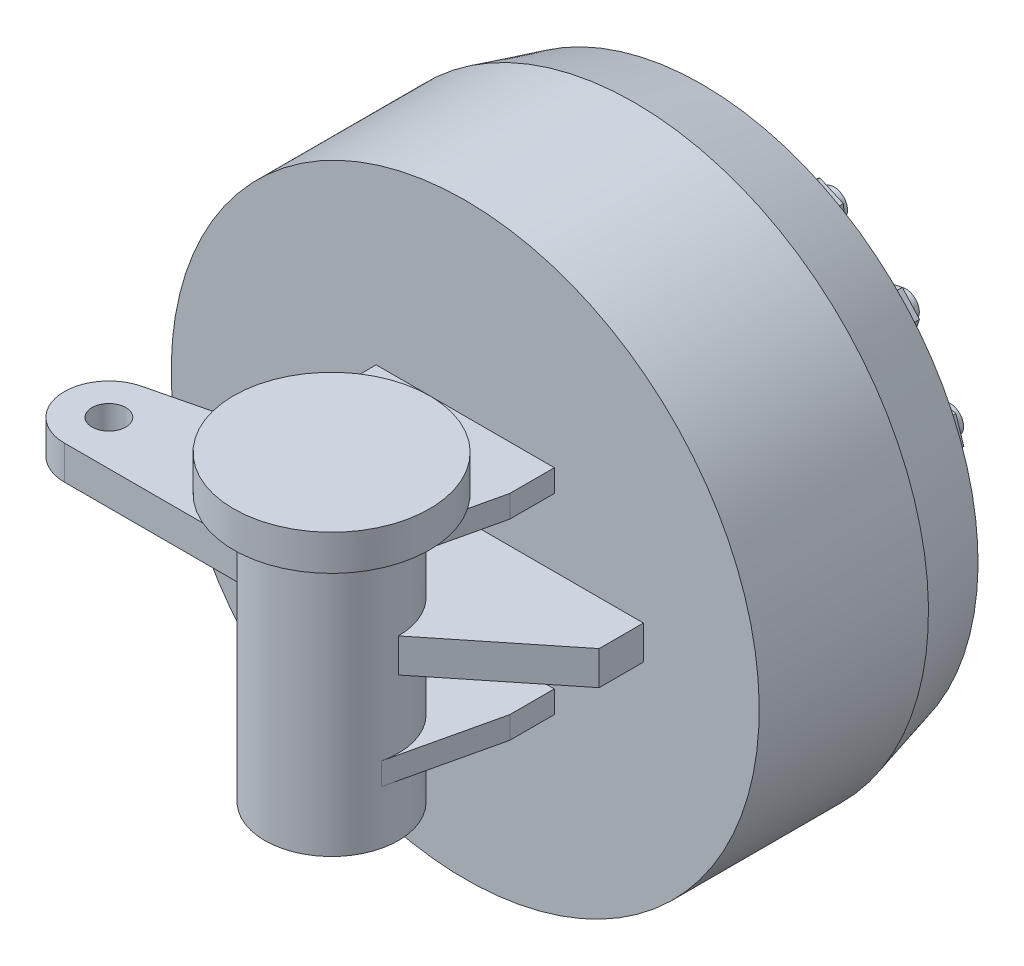
from build123d import *

# Parameters (mm, degrees)
CHAMFER1_SIZE            = 4
FILLET1_R                = 3.5
BOSS_EXTRUDE1_DEPTH      = 80
BOSS_EXTRUDE1_DEPTH_BACK = 90
SKETCH2_R                = 37.5
BOSS_EXTRUDE2_START      = 60
BOSS_EXTRUDE2_DEPTH      = 12.5
SKETCH4_R                = 9.5
BOSS_EXTRUDE3_DEPTH      = 9.5
SKETCH5_R                = 55
BOSS_EXTRUDE4_DEPTH      = 20
SKETCH6_R                = 7.5
BOSS_EXTRUDE5_DEPTH      = 25
BOSS_EXTRUDE6_START      = 6
SKETCH6_3_R              = 7.5
BOSS_EXTRUDE6_DEPTH      = 12.5
CIRPATTERN1_COUNT        = 15


with BuildPart() as part:
    # Sketch1 → Revolve1 (revolve)
    with BuildSketch(Plane(origin=(0, 0, 0), x_dir=(0, 0, -1), z_dir=(1, 0, 0))):
        Polygon((0, 0), (0, 165), (95, 165), (133, 154.817930688), (133, 75), (158, 75), (158, 50), (183, 50), (183, 0), align=None)
    revolve(axis=Axis((0, 0, -183), (0, 0, 1)))

    # Chamfer1
    chamfer1_edges = [part.edges().sort_by_distance(p)[0] for p in [
        (0, -50, -183),
    ]]
    chamfer(chamfer1_edges, length=CHAMFER1_SIZE)

    # Fillet1
    fillet1_edges = [part.edges().sort_by_distance(p)[0] for p in [
        (0, -50, -158),
        (0, -75, -158),
    ]]
    fillet(fillet1_edges, radius=FILLET1_R)



with BuildPart() as body_2:
    # Sketch2 → Boss-Extrude1 (new, two sides: drawn at the far end of the back side and taken through both)
    with BuildSketch(Plane(origin=(0, 0, 0), x_dir=(1, 0, 0), z_dir=(0, 1, 0)).offset(-BOSS_EXTRUDE1_DEPTH_BACK)):
        with Locations(Location((0, -75, 0), (0, 0, 270))):
            Circle(SKETCH2_R)
    extrude(amount=BOSS_EXTRUDE1_DEPTH + BOSS_EXTRUDE1_DEPTH_BACK)


with BuildPart() as part_1:
    add(part.part)

    add(body_2.part)  # Boss-Extrude2 merges body 2
    # Sketch3 → Boss-Extrude2 (add)
    with BuildSketch(Plane(origin=(0, 0, 0), x_dir=(1, 0, 0), z_dir=(0, 1, 0)).offset(BOSS_EXTRUDE2_START)):
        Polygon((-50, 0), (50, 0), (50, -25), (36.542960266, -83.417960266), (-36.542960266, -83.417960266), (-50, -25), align=None)
    boss_extrude2 = extrude(amount=-BOSS_EXTRUDE2_DEPTH)

    # Mirror1: Boss-Extrude2 across plane
    add(boss_extrude2.mirror(Plane.ZX))

    # Sketch4 → Boss-Extrude3 (add, symmetric)
    with BuildSketch(Plane(origin=(0, 0, 0), x_dir=(1, 0, 0), z_dir=(0, 1, 0))):
        with BuildLine():
            Line((-50, 0), (100, 0))
            Line((100, 0), (100, -24.832902827))
            Line((100, -24.832902827), (37.5, -75))
            ThreePointArc((37.5, -75), (0, -112.5), (-37.5, -75))
            Line((-37.5, -75), (-150, -75))
            ThreePointArc((-150, -75), (-174.822997079, -52.969649142), (-155.897247359, -25.705505282))
            Line((-155.897247359, -25.705505282), (-50, 0))
        make_face()
        with Locations(Location((-150, -50, 0), (0, 0, 270))):
            Circle(SKETCH4_R, mode=Mode.SUBTRACT)
    extrude(amount=BOSS_EXTRUDE3_DEPTH, both=True)

    # Sketch5 → Boss-Extrude4 (add)
    with BuildSketch(Plane(origin=(0, 60, 0), x_dir=(1, 0, 0), z_dir=(0, 1, 0))):
        with Locations(Location((0, -75, 0), (0, 0, 145.958125966))):
            Circle(SKETCH5_R)
    extrude(amount=BOSS_EXTRUDE4_DEPTH)

    # Sketch6 → Boss-Extrude5 (add)
    with BuildSketch(Plane(origin=(0, 0, -133), x_dir=(-1, 0, 0), z_dir=(0, 0, -1))):
        with Locations((-0.272578107, 120)):
            Circle(SKETCH6_R)
    boss_extrude5 = extrude(amount=BOSS_EXTRUDE5_DEPTH)

    # Sketch6<3> → Boss-Extrude6 (add)
    with BuildSketch(Plane(origin=(0, 0, -133), x_dir=(-1, 0, 0), z_dir=(0, 0, -1)).offset(BOSS_EXTRUDE6_START)):
        Polygon((-14.706334837, 120), (-7.489456472, 107.5), (6.944300258, 107.5), (14.161178623, 120), (6.944300258, 132.5), (-7.489456472, 132.5), align=None)
        with Locations((-0.272578107, 120)):
            Circle(SKETCH6_3_R, mode=Mode.SUBTRACT)
    boss_extrude6 = extrude(amount=BOSS_EXTRUDE6_DEPTH)

    # CirPattern1: Boss-Extrude5, Boss-Extrude6 ×15 about axis
    cirpattern1_axis = Axis((0, 0, 0), (0, 0, 1))
    add([boss_extrude5.rotate(cirpattern1_axis, i * 360 / CIRPATTERN1_COUNT) for i in range(1, CIRPATTERN1_COUNT)])
    add([boss_extrude6.rotate(cirpattern1_axis, i * 360 / CIRPATTERN1_COUNT) for i in range(1, CIRPATTERN1_COUNT)])


solid = part_1.part
